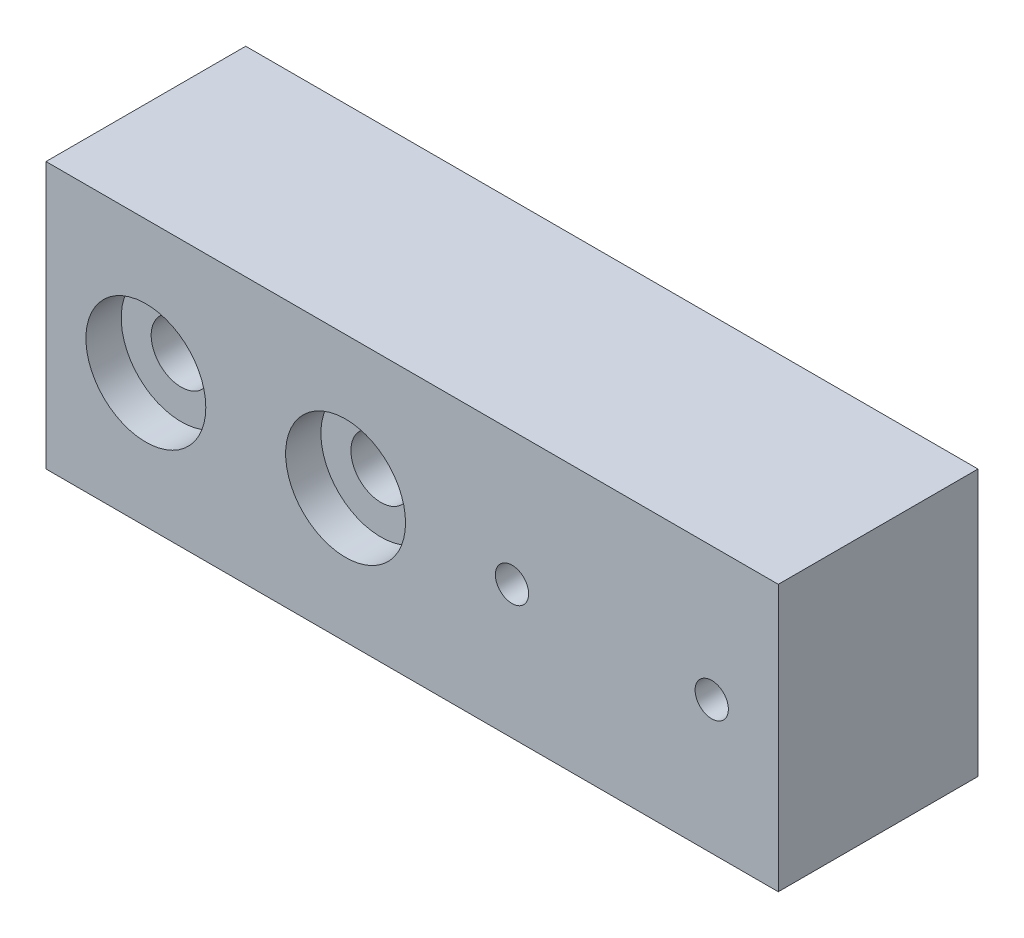
from build123d import *

# Parameters (mm, degrees)
SKETCH1_W                               = 110
SKETCH1_H                               = 40
BRACKET_DEPTH                           = 30
CBORE_FOR_M8_HEX_HEAD_BOLT1_D           = 9
CBORE_FOR_M8_HEX_HEAD_BOLT1_CBORE_D     = 18.011
CBORE_FOR_M8_HEX_HEAD_BOLT1_CBORE_DEPTH = 5.3
M6_TAPPED_HOLE1_D                       = 5
M6_TAPPED_HOLE1_DEPTH                   = 10
M6_TAPPED_HOLE1_TIP                     = 1.502151548


with BuildPart() as part:
    # Sketch1 → BRACKET (new body)
    with BuildSketch(Plane.XY):
        Rectangle(SKETCH1_W, SKETCH1_H)
    extrude(amount=BRACKET_DEPTH)

    # CBORE for M8 Hex Head Bolt1 (through all)
    with Locations(Plane.XY.offset(30)):
        with Locations((-40, 0), (-10, 0)):
            CounterBoreHole(CBORE_FOR_M8_HEX_HEAD_BOLT1_D / 2, CBORE_FOR_M8_HEX_HEAD_BOLT1_CBORE_D / 2, CBORE_FOR_M8_HEX_HEAD_BOLT1_CBORE_DEPTH)

    # M6 Tapped Hole1
    with Locations(Plane.XY.offset(30)):
        with Locations((15, 0), (45, 0)):
            Hole(M6_TAPPED_HOLE1_D / 2, depth=M6_TAPPED_HOLE1_DEPTH)
            with Locations((0, 0, -(M6_TAPPED_HOLE1_DEPTH + M6_TAPPED_HOLE1_TIP / 2))):  # 118° drill point
                Cone(0, M6_TAPPED_HOLE1_D / 2, M6_TAPPED_HOLE1_TIP, mode=Mode.SUBTRACT)


solid = part.part
